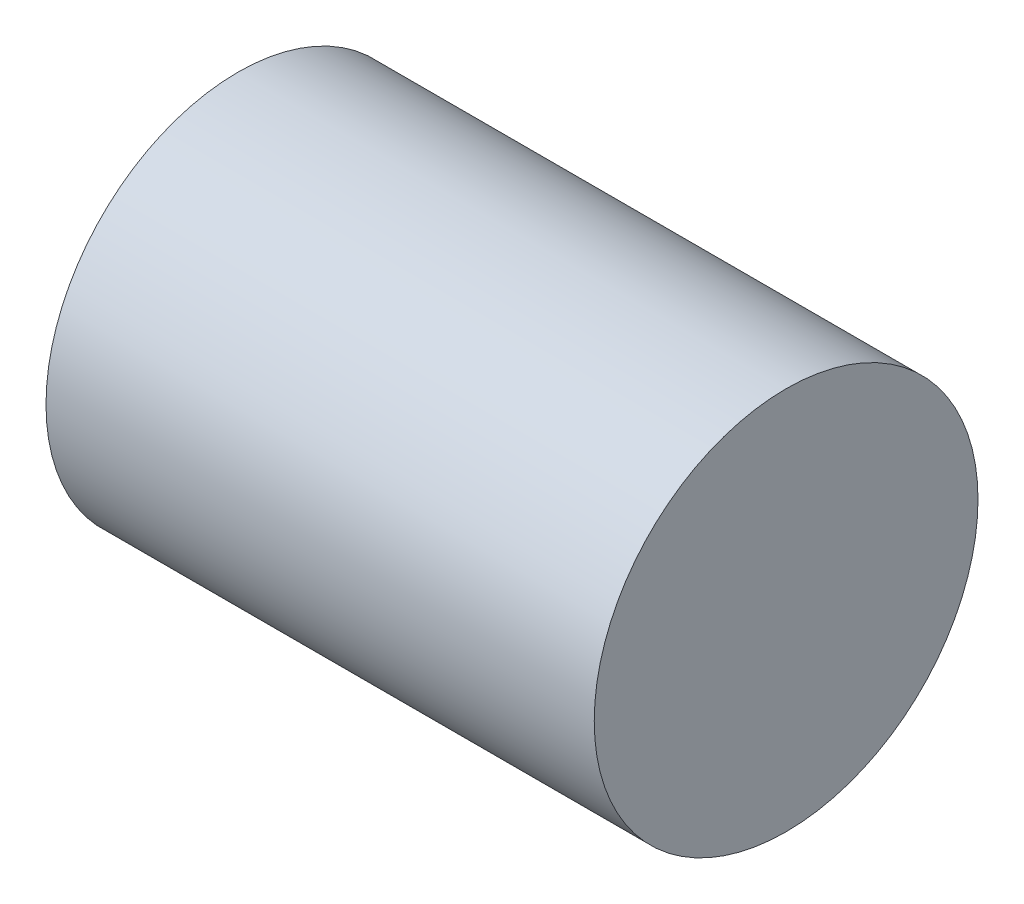
from build123d import *

# Parameters (mm, degrees)
SKETCH1_R           = 14
BOSS_EXTRUDE1_DEPTH = 40
SKETCH2_R           = 1.15
BOSS_EXTRUDE2_DEPTH = 6.5


with BuildPart() as part:
    # Sketch1 → Boss-Extrude1 (new body)
    with BuildSketch(Plane(origin=(0, 0, 0), x_dir=(0, 0, -1), z_dir=(1, 0, 0))):
        Circle(SKETCH1_R)
    extrude(amount=BOSS_EXTRUDE1_DEPTH)

    # Sketch2 → Boss-Extrude2 (add)
    with BuildSketch(Plane.ZY):
        with Locations(Location((0, 0, 0), (0, 0, 180))):
            Circle(SKETCH2_R)
    extrude(amount=BOSS_EXTRUDE2_DEPTH)


solid = part.part
